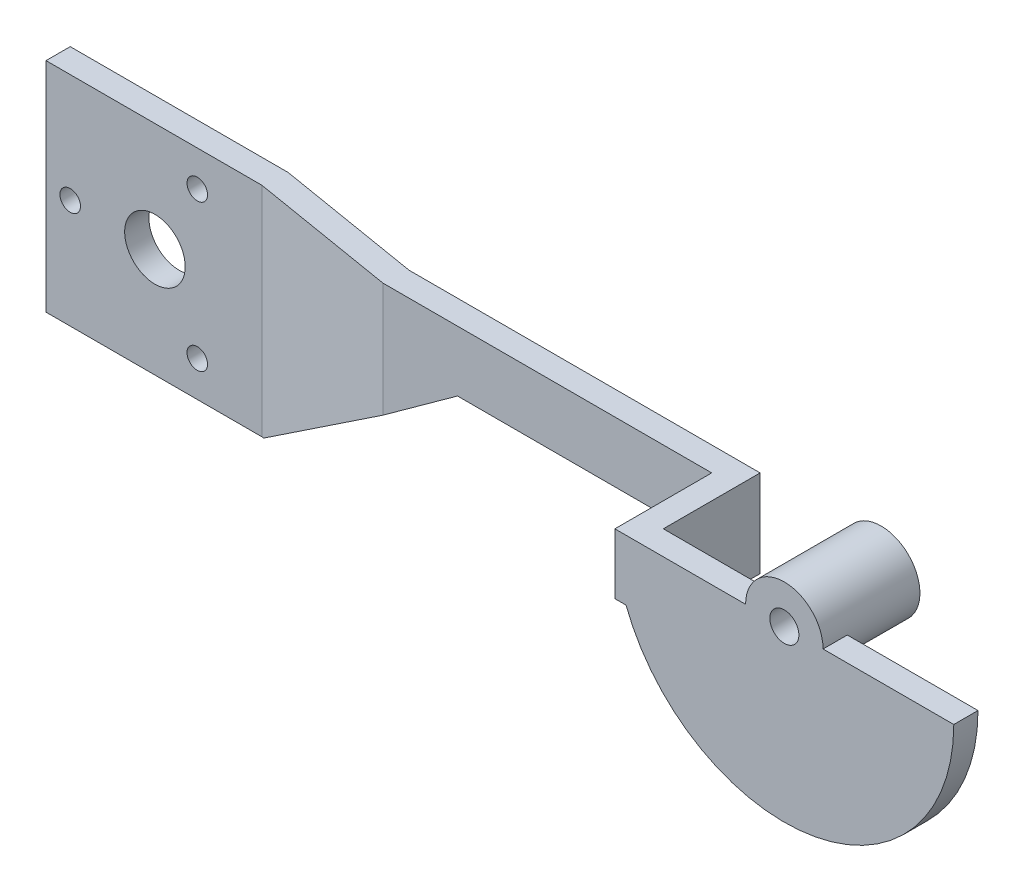
from build123d import *

# Parameters (mm, degrees)
ESQUISSE1_R             = 6
ESQUISSE1_R_2           = 4.25
BASE_EXTRUSION_DEPTH    = 60
ENL_V_MAT_EXTRU_1_DEPTH = 396.094925303
ENL_V_MAT_EXTRU_2_DEPTH = 10
ENL_V_MAT_EXTRU_3_DEPTH = 40
ESQUISSE5_R             = 12.5
ENL_V_MAT_EXTRU_4_DEPTH = 389.099214119
ESQUISSE6_R             = 16
ESQUISSE6_R_2           = 6
ENL_V_MAT_EXTRU_5_DEPTH = 10


with BuildPart() as part:
    # Esquisse1 → Base-Extrusion (new body)
    with BuildSketch(Plane.XY):
        with BuildLine():
            Line((380, 45), (326, 45))
            ThreePointArc((326, 45), (310, 61), (294, 45))
            Line((294, 45), (-45, 45))
            Line((-45, 45), (-45, -45))
            Line((-45, -45), (45, -45))
            Line((45, -45), (135, 20))
            Line((135, 20), (244.616515847, 20))
            ThreePointArc((244.616515847, 20), (322.711335675, -23.836196477), (380, 45))
        make_face()
        with Locations(Location((310, 45, 0), (0, 0, 180))):
            Circle(ESQUISSE1_R, mode=Mode.SUBTRACT)
        with Locations(Location((-35, 0, 0), (0, 0, 180))):
            Circle(ESQUISSE1_R_2, mode=Mode.SUBTRACT)
        with Locations(Location((17.5, 30.310889132, 0), (0, 0, 180))):
            Circle(ESQUISSE1_R_2, mode=Mode.SUBTRACT)
        with Locations(Location((17.5, -30.310889132, 0), (0, 0, 180))):
            Circle(ESQUISSE1_R_2, mode=Mode.SUBTRACT)
    extrude(amount=BASE_EXTRUSION_DEPTH)

    # Esquisse2 → Enlèv. mat.-Extru.1 (cut, through all)
    with BuildSketch(Plane(origin=(0, 45, 0), x_dir=(-1, 0, 0), z_dir=(0, 1, 0))):
        Polygon((-294, 50), (-294, 10), (-326, 10), (-326, 50), (-380, 50), (-380, 0), (-45, 0), (-105, 10), (-250, 10), (-250, 50), align=None)
        Polygon((-240, 60), (-240, 20), (-104.172374697, 20), (-44.172374697, 10), (45, 10), (45, 60), align=None)
    extrude(amount=-ENL_V_MAT_EXTRU_1_DEPTH, mode=Mode.SUBTRACT)

    # Esquisse3 → Enlèv. mat.-Extru.2 (cut)
    with BuildSketch(Plane(origin=(0, 0, 0), x_dir=(-1, 0, 0), z_dir=(0, 0, -1))):
        with BuildLine():
            Line((-304, 45), (-294, 45))
            ThreePointArc((-294, 45), (-310, 61), (-326, 45))
            Line((-326, 45), (-316, 45))
            ThreePointArc((-316, 45), (-310, 51), (-304, 45))
        make_face()
    extrude(amount=-ENL_V_MAT_EXTRU_2_DEPTH, mode=Mode.SUBTRACT)

    # Esquisse4 → Enlèv. mat.-Extru.3 (cut)
    with BuildSketch(Plane(origin=(0, 0, 10), x_dir=(-1, 0, 0), z_dir=(0, 0, -1))):
        with BuildLine():
            ThreePointArc((-326, -23.14690015), (-310, -25), (-294, -23.14690015))
            Line((-294, -23.14690015), (-294, 45))
            ThreePointArc((-294, 45), (-310, 29), (-326, 45))
            Line((-326, 45), (-326, -23.14690015))
        make_face()
    extrude(amount=-ENL_V_MAT_EXTRU_3_DEPTH, mode=Mode.SUBTRACT)

    # Esquisse5 → Enlèv. mat.-Extru.4 (cut, through all)
    with BuildSketch(Plane.XY.offset(10)):
        Circle(ESQUISSE5_R)
    extrude(amount=-ENL_V_MAT_EXTRU_4_DEPTH, mode=Mode.SUBTRACT)

    # Esquisse6 → Enlèv. mat.-Extru.5 (cut)
    with BuildSketch(Plane(origin=(0, 0, 10), x_dir=(-1, 0, 0), z_dir=(0, 0, -1))):
        with Locations((-310, 45)):
            Circle(ESQUISSE6_R)
        with Locations((-310, 45)):
            Circle(ESQUISSE6_R_2, mode=Mode.SUBTRACT)
    extrude(amount=-ENL_V_MAT_EXTRU_5_DEPTH, mode=Mode.SUBTRACT)


solid = part.part
